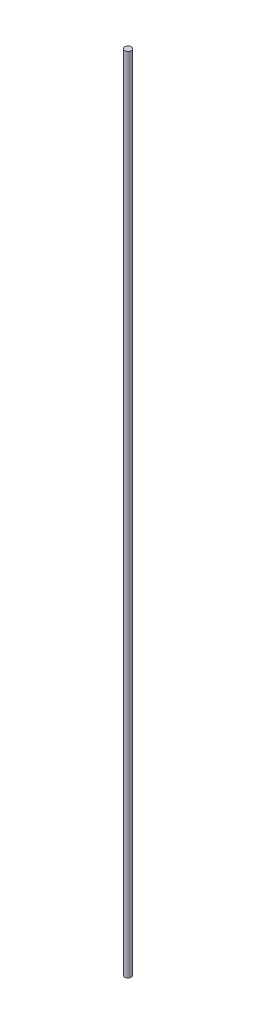
from build123d import *

# Parameters (mm, degrees)
SKETCH1_R           = 2.5
BOSS_EXTRUDE1_DEPTH = 600


with BuildPart() as part:
    # Sketch1 → Boss-Extrude1 (new body)
    with BuildSketch(Plane(origin=(0, 0, 0), x_dir=(1, 0, 0), z_dir=(0, 1, 0))):
        with Locations(Location((0, 0, 0), (0, 0, 270))):
            Circle(SKETCH1_R)
    extrude(amount=BOSS_EXTRUDE1_DEPTH)


solid = part.part
